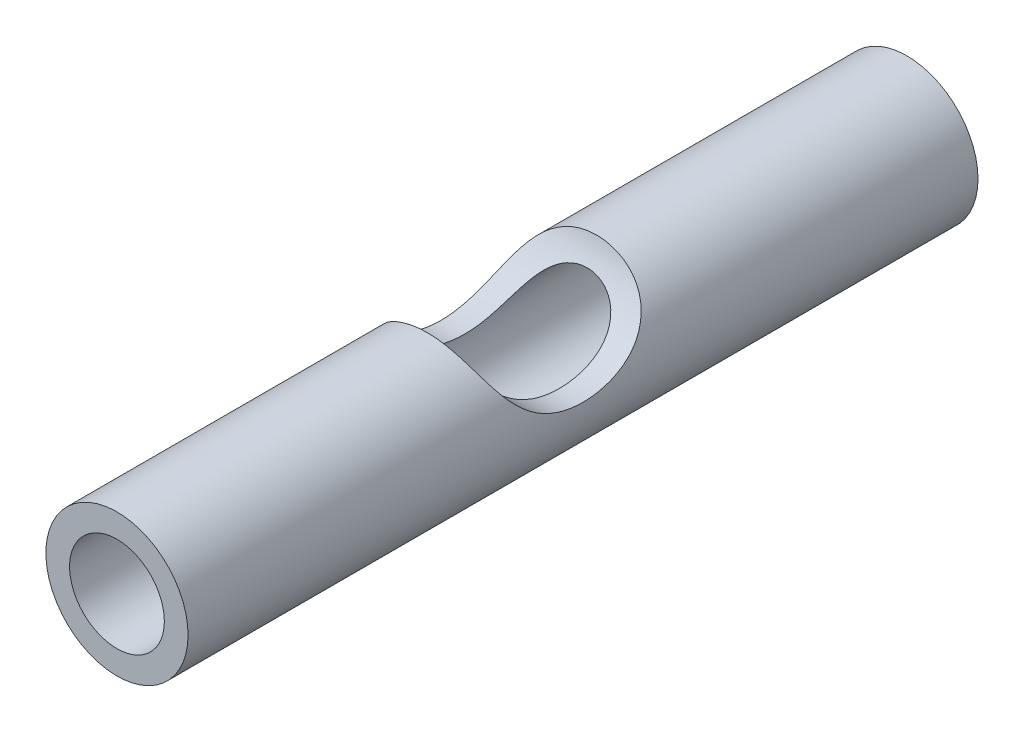
from build123d import *

# Parameters (mm, degrees)
BOSS_EXTRUDE1_DEPTH      = 100
BOSS_EXTRUDE1_DEPTH_BACK = 100
SKETCH1_R                = 18
SKETCH1_R_2              = 12
CUT_EXTRUDE1_DEPTH       = 104.189146716
CUT_EXTRUDE1_DEPTH_BACK  = 104.189146716
SKETCH2_R                = 22


with BuildPart() as part:
    # Sketch1 → Boss-Extrude1 (new, two sides: drawn at the far end of the back side and taken through both)
    with BuildSketch(Plane.XY.offset(-BOSS_EXTRUDE1_DEPTH_BACK)):
        Circle(SKETCH1_R)
        Circle(SKETCH1_R_2, mode=Mode.SUBTRACT)
    extrude(amount=BOSS_EXTRUDE1_DEPTH + BOSS_EXTRUDE1_DEPTH_BACK)

    # Sketch2 → Cut-Extrude1 (cut, two sides: drawn at the far end of the back side and taken through both)
    with BuildSketch(Plane(origin=(0, 0, 0), x_dir=(0, 0, -1), z_dir=(1, 0, 0)).offset(-CUT_EXTRUDE1_DEPTH_BACK)):
        with Locations((0, 23)):
            Circle(SKETCH2_R)
    extrude(amount=CUT_EXTRUDE1_DEPTH + CUT_EXTRUDE1_DEPTH_BACK, mode=Mode.SUBTRACT)


solid = part.part
